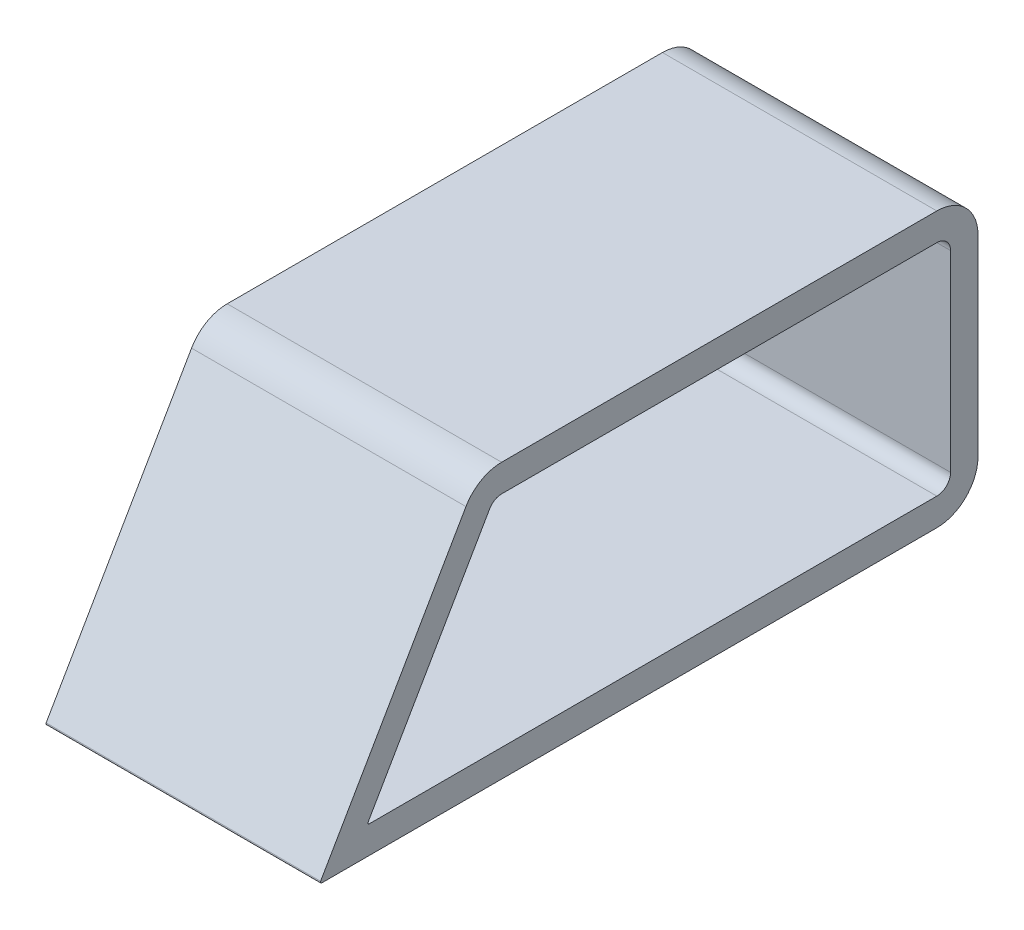
from build123d import *

# Parameters (mm, degrees)
BOSS_EXTRUDE1_DEPTH = 254
FILLET1_R           = 2.54


with BuildPart() as part:
    # Sketch1 → Boss-Extrude1 (new, symmetric)
    with BuildSketch(Plane(origin=(0, 0, 0), x_dir=(0, 0, -1), z_dir=(1, 0, 0))):
        with BuildLine():
            Line((0, 0), (271.296891492, 469.9))
            ThreePointArc((271.296891492, 469.9), (299.188027261, 497.791135768), (337.288027261, 508))
            Line((337.288027261, 508), (1143, 508))
            ThreePointArc((1143, 508), (1196.881536726, 485.681536726), (1219.2, 431.8))
            Line((1219.2, 431.8), (1219.2, 76.2))
            ThreePointArc((1219.2, 76.2), (1196.881536726, 22.318463274), (1143, 0))
            Line((1143, 0), (0, 0))
        make_face()
        with BuildLine():
            Line((337.288027261, 457.2), (1143, 457.2))
            ThreePointArc((1143, 457.2), (1160.960512242, 449.760512242), (1168.4, 431.8))
            Line((1168.4, 431.8), (1168.4, 76.2))
            ThreePointArc((1168.4, 76.2), (1160.960512242, 58.239487758), (1143, 50.8))
            Line((1143, 50.8), (87.988181024, 50.8))
            Line((87.988181024, 50.8), (315.290982004, 444.5))
            ThreePointArc((315.290982004, 444.5), (324.588027261, 453.797045256), (337.288027261, 457.2))
        make_face(mode=Mode.SUBTRACT)
    extrude(amount=BOSS_EXTRUDE1_DEPTH, both=True)

    # Fillet1
    fillet1_edges = [part.edges().sort_by_distance(p)[0] for p in [
        (0, 0, 0),
        (0, 50.8, -87.988181024),
    ]]
    fillet(fillet1_edges, radius=FILLET1_R)


solid = part.part
